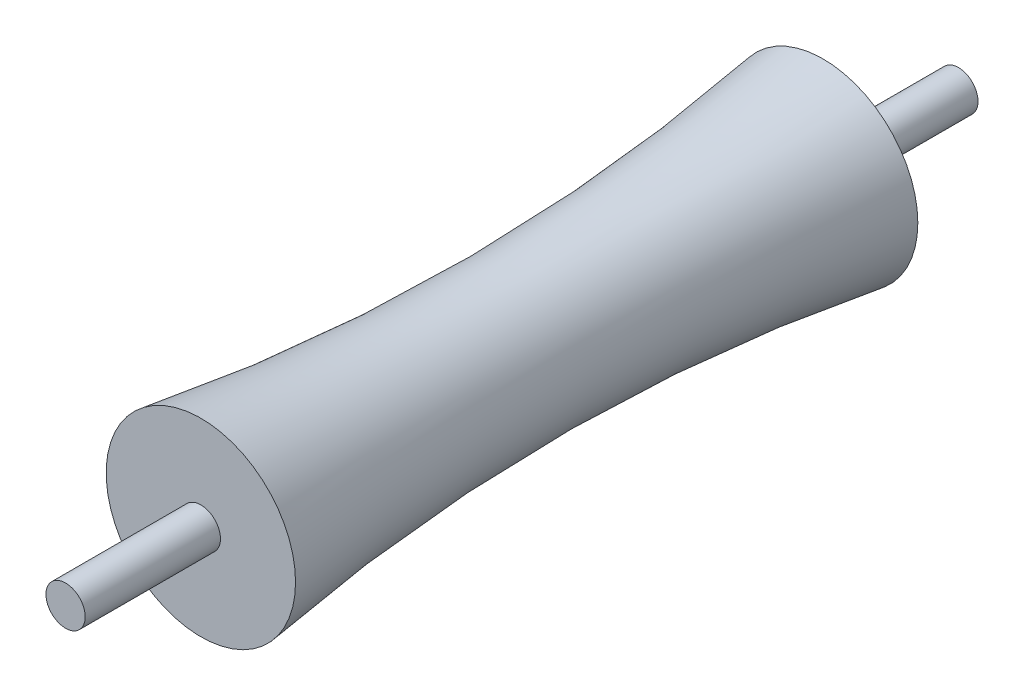
from build123d import *

# Parameters (mm, degrees)
SKETCH2_R           = 1.45
BOSS_EXTRUDE1_DEPTH = 10
BOSS_EXTRUDE2_START = 10
SKETCH3_R           = 1.45
BOSS_EXTRUDE2_DEPTH = 10


with BuildPart() as part:
    # Sketch1 → Revolve1 (revolve)
    with BuildSketch(Plane(origin=(0, 0, 0), x_dir=(1, 0, 0), z_dir=(0, 1, 0))):
        with BuildLine():
            Line((0, 0), (0, 46))
            Line((0, 46), (7, 46))
            ThreePointArc((7, 46), (5.226178525, 23), (7, 0))
            Line((7, 0), (0, 0))
        make_face()
    revolve(axis=Axis((0, 0, 0), (0, 0, -1)))

    # Sketch2 → Boss-Extrude1 (add)
    with BuildSketch(Plane.XY):
        Circle(SKETCH2_R)
    extrude(amount=BOSS_EXTRUDE1_DEPTH)

    # Sketch3 → Boss-Extrude2 (add)
    with BuildSketch(Plane(origin=(0, 0, -46), x_dir=(-1, 0, 0), z_dir=(0, 0, -1)).offset(BOSS_EXTRUDE2_START)):
        with Locations(Location((0, 0, 0), (0, 0, 180))):
            Circle(SKETCH3_R)
    extrude(amount=-BOSS_EXTRUDE2_DEPTH)


solid = part.part
